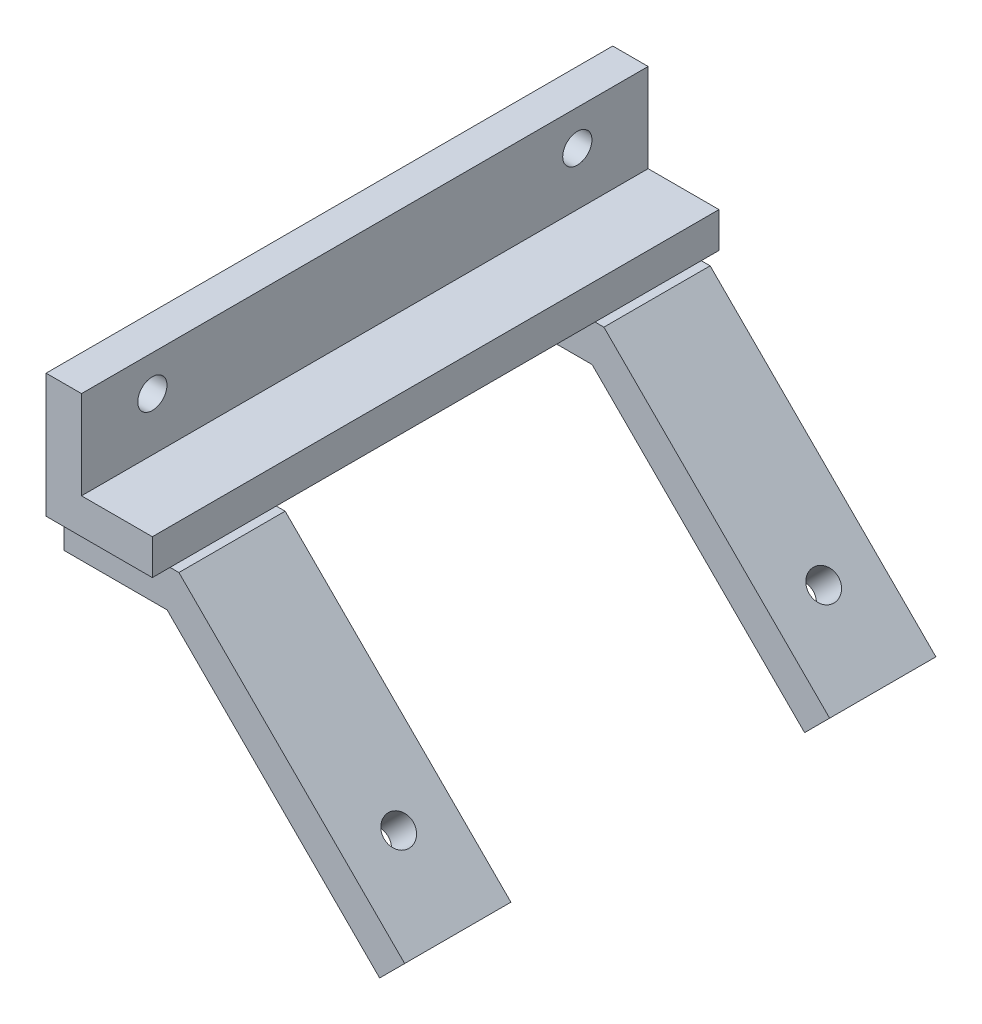
from build123d import *

# Parameters (mm, degrees)
FDM_4MM_START                 = -32
FDM_4MM_DEPTH                 = 64
EXTRUDE_START                 = -30
EXTRUDE_45_1_DEPTH            = 12
CUT_EXTRUDE_M3_1_DEPTH        = 100
CUT_EXTRUDE_M3_1_DEPTH_BACK   = 100
SKETCH_3_R                    = 1.65
EXTRUDE_START_2               = 18
EXTRUDE_45_1_2_DEPTH          = 12
CUT_EXTRUDE_M3_1_2_DEPTH      = 100
CUT_EXTRUDE_M3_1_2_DEPTH_BACK = 100
SKETCH_5_R                    = 1.65
CUT_EXTRUDE_M3_1_3_DEPTH      = 100
CUT_EXTRUDE_M3_1_3_DEPTH_BACK = 100
SKETCH_6_R                    = 1.65
CUT_EXTRUDE_M3_1_4_DEPTH      = 100
CUT_EXTRUDE_M3_1_4_DEPTH_BACK = 100
SKETCH_7_R                    = 1.65


with BuildPart() as part:
    # 草图1 → FDM侧板连接根部_4mm壁 (new body)
    with BuildSketch(Plane.XY.offset(FDM_4MM_START)):
        Polygon((0, 0), (12, 0), (12, 4), (4, 4), (4, 14), (0, 14), align=None)
    extrude(amount=FDM_4MM_DEPTH)

    # 草图2 → Extrude 45__-1 (add)
    with BuildSketch(Plane.XY.offset(EXTRUDE_START)):
        Polygon((0, 0), (0, 14), (4, 14), (4, 0), (13, 0), (14.5, -1.5), (38.5, -25.5), (35.671572875, -28.328427125), (11.671572875, -4.328427125), (0, -4.328427125), align=None)
    extrude(amount=EXTRUDE_45_1_DEPTH)

    # 草图3 → Cut-Extrude M3__-1 (cut, two sides: drawn at the far end of the back side and taken through both)
    with BuildSketch(Plane(origin=(0, 0, 0), x_dir=(0, 0, -1), z_dir=(1, 0, 0)).offset(-CUT_EXTRUDE_M3_1_DEPTH_BACK)):
        with Locations((24, 10)):
            Circle(SKETCH_3_R)
    extrude(amount=CUT_EXTRUDE_M3_1_DEPTH + CUT_EXTRUDE_M3_1_DEPTH_BACK, mode=Mode.SUBTRACT)

    # 草图4 → Extrude 45__1 2 (add)
    with BuildSketch(Plane.XY.offset(EXTRUDE_START_2)):
        Polygon((0, 0), (0, 14), (4, 14), (4, 0), (13, 0), (14.5, -1.5), (38.5, -25.5), (35.671572875, -28.328427125), (11.671572875, -4.328427125), (0, -4.328427125), align=None)
    extrude(amount=EXTRUDE_45_1_2_DEPTH)

    # 草图5 → Cut-Extrude M3__1 2 (cut, two sides: drawn at the far end of the back side and taken through both)
    with BuildSketch(Plane(origin=(0, 0, 0), x_dir=(0, 0, -1), z_dir=(1, 0, 0)).offset(-CUT_EXTRUDE_M3_1_2_DEPTH_BACK)):
        with Locations((-24, 10)):
            Circle(SKETCH_5_R)
    extrude(amount=CUT_EXTRUDE_M3_1_2_DEPTH + CUT_EXTRUDE_M3_1_2_DEPTH_BACK, mode=Mode.SUBTRACT)

    # 草图6 → Cut-Extrude M3_-1 3 (cut, two sides: drawn at the far end of the back side and taken through both)
    with BuildSketch(Plane(origin=(6.5, 6.5, 0), x_dir=(0, 0, -1), z_dir=(0.7071067811865472, 0.7071067811865479, 0)).offset(-CUT_EXTRUDE_M3_1_3_DEPTH_BACK)):
        with Locations(Location((24, -35.813708499, 0), (0, 0, 90))):
            Circle(SKETCH_6_R)
    extrude(amount=CUT_EXTRUDE_M3_1_3_DEPTH + CUT_EXTRUDE_M3_1_3_DEPTH_BACK, mode=Mode.SUBTRACT)

    # 草图7 → Cut-Extrude M3_1 4 (cut, two sides: drawn at the far end of the back side and taken through both)
    with BuildSketch(Plane(origin=(6.5, 6.5, 0), x_dir=(0, 0, -1), z_dir=(0.7071067811865472, 0.7071067811865479, 0)).offset(-CUT_EXTRUDE_M3_1_4_DEPTH_BACK)):
        with Locations(Location((-24, -35.813708499, 0), (0, 0, 90))):
            Circle(SKETCH_7_R)
    extrude(amount=CUT_EXTRUDE_M3_1_4_DEPTH + CUT_EXTRUDE_M3_1_4_DEPTH_BACK, mode=Mode.SUBTRACT)


solid = part.part
